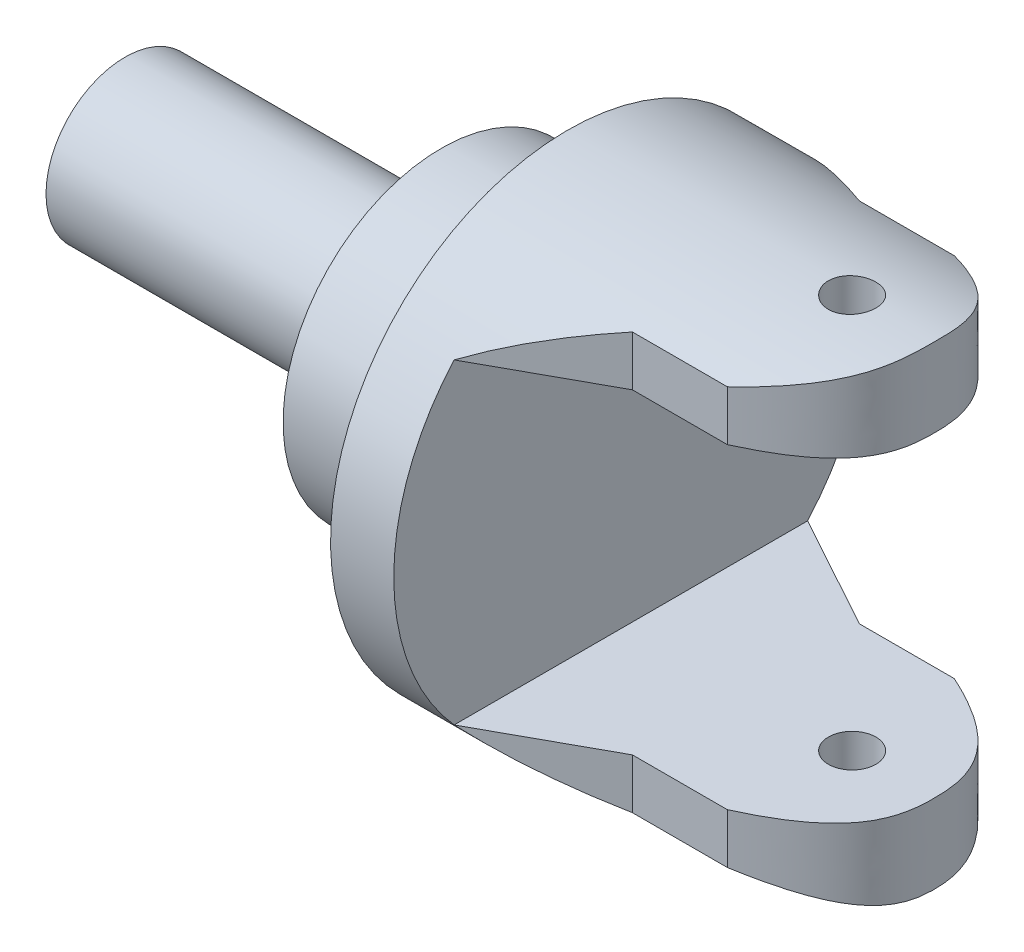
from build123d import *

# Parameters (mm, degrees)
SKETCH1_R               = 5
BOSS_EXTRUDE1_DEPTH     = 4
SKETCH2_R               = 7.5
BOSS_EXTRUDE2_DEPTH     = 2
BOSS_EXTRUDE3_DEPTH     = 10
CUT_EXTRUDE1_DEPTH      = 22.644860822
CUT_EXTRUDE1_DEPTH_BACK = 22.644860822
CUT_EXTRUDE2_DEPTH      = 22.350878369
CUT_EXTRUDE2_DEPTH_BACK = 22.350878369
SKETCH5_R               = 0.75
SKETCH6_R               = 2.5
BOSS_EXTRUDE4_DEPTH     = 10


with BuildPart() as part:
    # Sketch1 → Boss-Extrude1 (new body)
    with BuildSketch(Plane(origin=(0, 0, 0), x_dir=(0, 0, -1), z_dir=(1, 0, 0))):
        Circle(SKETCH1_R)
    extrude(amount=BOSS_EXTRUDE1_DEPTH)

    # Sketch2 → Boss-Extrude2 (add)
    with BuildSketch(Plane(origin=(4, 0, 0), x_dir=(0, 0, -1), z_dir=(1, 0, 0))):
        Circle(SKETCH2_R)
    extrude(amount=BOSS_EXTRUDE2_DEPTH)

    # Sketch3 → Boss-Extrude3 (add)
    with BuildSketch(Plane(origin=(6, 0, 0), x_dir=(0, 0, -1), z_dir=(1, 0, 0))):
        with BuildLine():
            ThreePointArc((5.590169944, 5), (0, 7.5), (-5.590169944, 5))
            Line((-5.590169944, 5), (-4.898979486, 5))
            Line((-4.898979486, 5), (4.898979486, 5))
            Line((4.898979486, 5), (5.590169944, 5))
        make_face()
        with BuildLine():
            Line((-4.898979486, -5), (-5.590169944, -5))
            ThreePointArc((-5.590169944, -5), (0, -7.5), (5.590169944, -5))
            Line((5.590169944, -5), (4.898979486, -5))
            Line((4.898979486, -5), (-4.898979486, -5))
        make_face()
    extrude(amount=BOSS_EXTRUDE3_DEPTH)

    # Sketch4 → Cut-Extrude1 (cut, two sides: drawn at the far end of the back side and taken through both)
    with BuildSketch(Plane.XZ.offset(-5).offset(-CUT_EXTRUDE1_DEPTH_BACK)):
        with BuildLine():
            Line((6, 5.590169944), (16, 5.590169944))
            Line((16, 5.590169944), (16, -5.590169944))
            Line((16, -5.590169944), (6, -5.590169944))
            Line((6, -5.590169944), (9.640400827, -3.590169944))
            Line((9.640400827, -3.590169944), (12.640400827, -3.590169944))
            add(Edge.make_bspline(
                [(12.640400827, -3.590169944), (15.280133609, -2.393446629), (15.919866391, 0), (15.280133609, 2.393446629), (12.640400827, 3.590169944)],
                knots=[0.178885438, 0.178885438, 0.178885438, 0.178885438, 0.5, 0.821114562, 0.821114562, 0.821114562, 0.821114562], degree=3))
            Line((12.640400827, 3.590169944), (9.640400827, 3.590169944))
            Line((9.640400827, 3.590169944), (6, 5.590169944))
        make_face()
    extrude(amount=CUT_EXTRUDE1_DEPTH + CUT_EXTRUDE1_DEPTH_BACK, mode=Mode.SUBTRACT)

    # Sketch5 → Cut-Extrude2 (cut, two sides: drawn at the far end of the back side and taken through both)
    with BuildSketch(Plane.XZ.offset(-5).offset(-CUT_EXTRUDE2_DEPTH_BACK)):
        with Locations(Location((13, 0, 0), (0, 0, 270))):
            Circle(SKETCH5_R)
    extrude(amount=CUT_EXTRUDE2_DEPTH + CUT_EXTRUDE2_DEPTH_BACK, mode=Mode.SUBTRACT)

    # Sketch6 → Boss-Extrude4 (add)
    with BuildSketch(Plane.ZY):
        Circle(SKETCH6_R)
    extrude(amount=BOSS_EXTRUDE4_DEPTH)


solid = part.part
